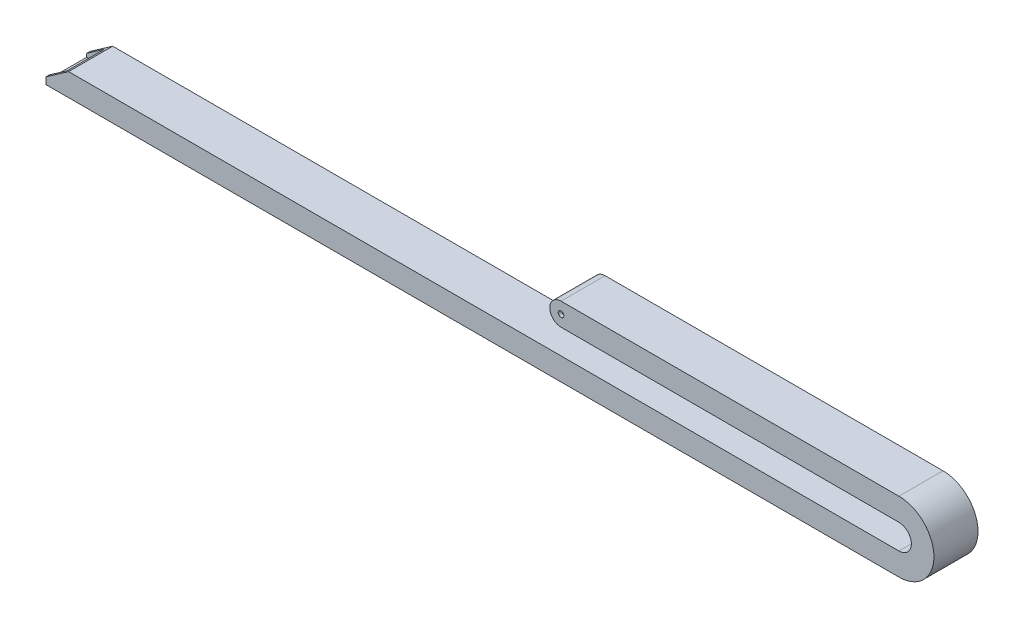
from build123d import *

# Parameters (mm, degrees)
BOSS_EXTRUDE1_DEPTH = 39
SHELL1_T            = -3
SKETCH2_W           = 33
SKETCH2_H           = 14
CUT_EXTRUDE1_DEPTH  = 455.896372
SKETCH3_R           = 2.5
CUT_EXTRUDE2_DEPTH  = 456.047881521


with BuildPart() as part:
    # Sketch1 → Boss-Extrude1 (new body)
    with BuildSketch(Plane.XY):
        with BuildLine():
            Line((309.062127233, 40), (-425.902299809, 40))
            Line((-425.902299809, 40), (-445.896371903, 26))
            Line((-445.896371903, 26), (-445.896371903, 20))
            Line((-445.896371903, 20), (309.062127233, 20))
            ThreePointArc((309.062127233, 20), (340.062127233, 51), (309.062127233, 82))
            Line((309.062127233, 82), (10, 82))
            ThreePointArc((10, 82), (0, 72), (10, 62))
            Line((10, 62), (309.062127233, 62))
            ThreePointArc((309.062127233, 62), (320.062127233, 51), (309.062127233, 40))
        make_face()
    extrude(amount=BOSS_EXTRUDE1_DEPTH)

    # Shell1
    shell1_openings = [part.faces().sort_by_distance(p)[0] for p in [
        (-435.899335856, 33, 19.5),
    ]]
    offset(amount=SHELL1_T, openings=shell1_openings, kind=Kind.INTERSECTION)

    # Sketch2 → Cut-Extrude1 (cut)
    with BuildSketch(Plane.ZY.offset(445.896371903)):
        with Locations((19.5, 72)):
            Rectangle(SKETCH2_W, SKETCH2_H)
        with Locations((19.5, 30)):
            Rectangle(SKETCH2_W, SKETCH2_H)
    extrude(amount=-CUT_EXTRUDE1_DEPTH, mode=Mode.SUBTRACT)

    # Sketch3 → Cut-Extrude2 (cut, through all)
    with BuildSketch(Plane.XY.offset(39)):
        with Locations((10, 72)):
            Circle(SKETCH3_R)
    extrude(amount=-CUT_EXTRUDE2_DEPTH, mode=Mode.SUBTRACT)


solid = part.part
